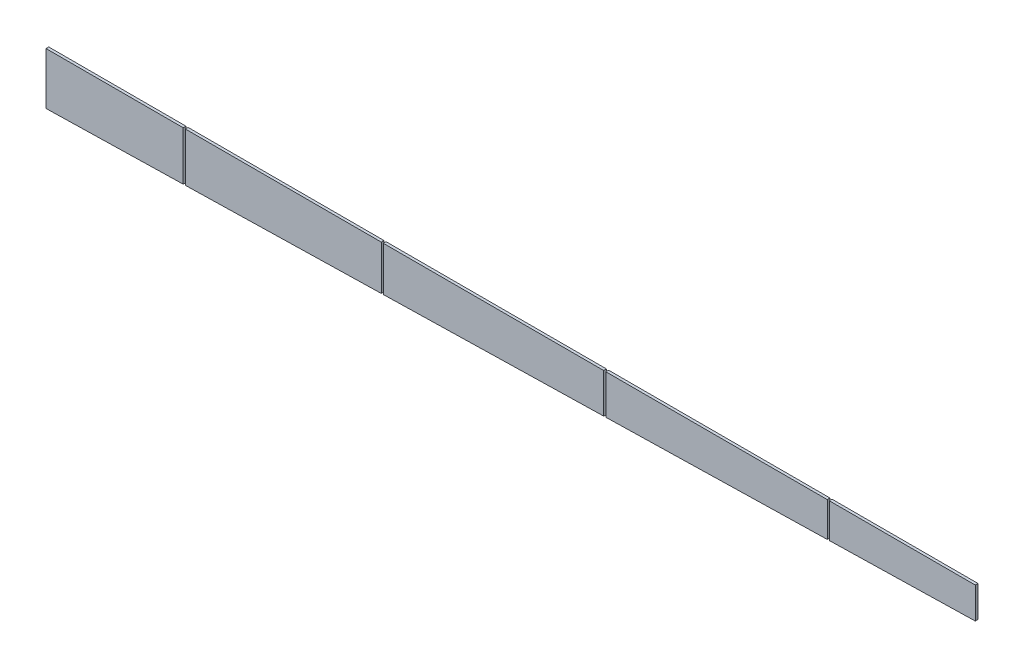
from build123d import *

# Parameters (mm, degrees)
EXTRUDE_1_DEPTH   = 2
EXTRUDE_1_2_DEPTH = 2
EXTRUDE_1_3_DEPTH = 2
EXTRUDE_1_4_DEPTH = 2
EXTRUDE_1_5_DEPTH = 2


with BuildPart() as part:
    # Model → 凸台-拉伸1 (new body)
    with BuildSketch(Plane.XY):
        Polygon((443.787377051, 361.818846768), (443.787377051, 323.803187424), (544.202532921, 326.044820391), (544.202532921, 361.818846768), align=None)
    extrude(amount=EXTRUDE_1_DEPTH)


with BuildPart() as body_2:
    # Model → Extrude 1 2 (new body)
    with BuildSketch(Plane.XY):
        Polygon((545.702532921, 361.818846768), (545.702532921, 326.078305869), (689.106151826, 329.279598312), (689.106151826, 361.818846768), align=None)
    extrude(amount=EXTRUDE_1_2_DEPTH)


with BuildPart() as body_3:
    # Model → Extrude 1 3 (new body)
    with BuildSketch(Plane.XY):
        Polygon((690.606151826, 361.818846768), (690.606151826, 329.31308379), (851.883517512, 332.913383532), (851.883517512, 361.818846768), align=None)
    extrude(amount=EXTRUDE_1_3_DEPTH)


with BuildPart() as body_4:
    # Model → Extrude 1 4 (new body)
    with BuildSketch(Plane.XY):
        Polygon((853.383517512, 361.818846768), (853.383517512, 332.94686901), (1015.441597844, 336.564597153), (1015.441597844, 361.818846768), align=None)
    extrude(amount=EXTRUDE_1_4_DEPTH)


with BuildPart() as body_5:
    # Model → Extrude 1 5 (new body)
    with BuildSketch(Plane.XY):
        Polygon((1016.941597844, 361.818846768), (1016.941597844, 336.598082631), (1123.744283191, 338.982308581), (1123.744283191, 361.818846768), align=None)
    extrude(amount=EXTRUDE_1_5_DEPTH)


solid = Compound([part.part, body_2.part, body_3.part, body_4.part, body_5.part])
